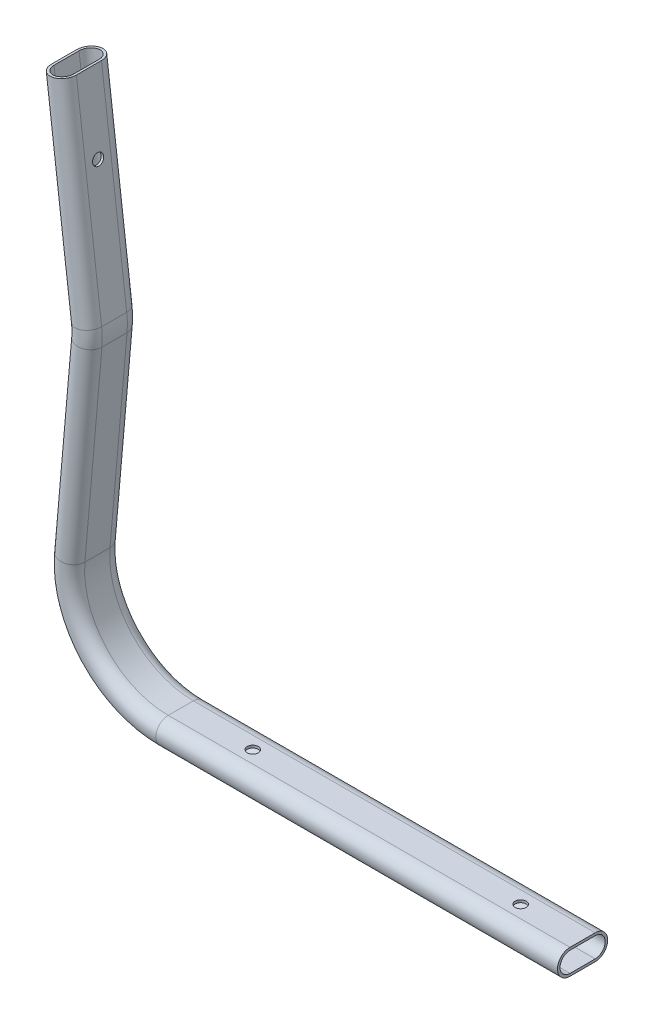
from build123d import *

# Parameters (mm, degrees)
SKETCH_3_R          = 3.3
CUT_EXTRUDE_1_DEPTH = 435.163655166
SKETCH_4_R          = 3.3
CUT_EXTRUDE_2_DEPTH = 432.316912752


with BuildPart() as part:
    # По траектории1: sweep along a path in Эскиз1
    with BuildLine(Plane.XY) as sweep_1_path:
        Line((0, 0), (-240, 0))
        ThreePointArc((-240, 0), (-287.923026893, 21.086636505), (-304.752655376, 70.665123279))
        Line((-304.752655376, 70.665123279), (-294.57908638, 186.949549004))
        ThreePointArc((-294.57908638, 186.949549004), (-294.451231483, 190.610834225), (-294.706785506, 194.265427019))
        Line((-294.706785506, 194.265427019), (-309.776696157, 317))
    # Эскиз2 → По траектории1 (sweep)
    with BuildSketch(Plane(origin=(0, 0, 0), x_dir=(0, 0, -1), z_dir=(1, 0, 0))):
        with BuildLine():
            Line((-7.5, 15), (7.5, 15))
            ThreePointArc((7.5, 15), (15, 7.5), (7.5, 0))
            Line((7.5, 0), (-7.5, 0))
            ThreePointArc((-7.5, 0), (-15, 7.5), (-7.5, 15))
        make_face()
        with BuildLine():
            Line((-7.5, 13.5), (7.5, 13.5))
            ThreePointArc((7.5, 13.5), (13.5, 7.5), (7.5, 1.5))
            Line((7.5, 1.5), (-7.5, 1.5))
            ThreePointArc((-7.5, 1.5), (-13.5, 7.5), (-7.5, 13.5))
        make_face(mode=Mode.SUBTRACT)
    sweep(path=sweep_1_path.line)

    # Эскиз3 → Вырез-Вытянуть1 (cut, through all)
    with BuildSketch(Plane(origin=(0, 15, 0), x_dir=(1, 0, 0), z_dir=(0, 1, 0))):
        with Locations(Location((-197, 0, 0), (0, 0, 180))):
            Circle(SKETCH_3_R)
        with Locations(Location((-37, 0, 0), (0, 0, 180))):
            Circle(SKETCH_3_R)
    extrude(amount=-CUT_EXTRUDE_1_DEPTH, mode=Mode.SUBTRACT)

    # Эскиз4 → Вырез-Вытянуть2 (cut, through all)
    with BuildSketch(Plane(origin=(-251.943037542, -30.934715237, 0), x_dir=(0, 0, -1), z_dir=(0.9925461516413225, 0.12186934340514467, 0))):
        with Locations(Location((0, 307.389412633, 0), (0, 0, 90))):
            Circle(SKETCH_4_R)
    extrude(amount=-CUT_EXTRUDE_2_DEPTH, mode=Mode.SUBTRACT)


solid = part.part
